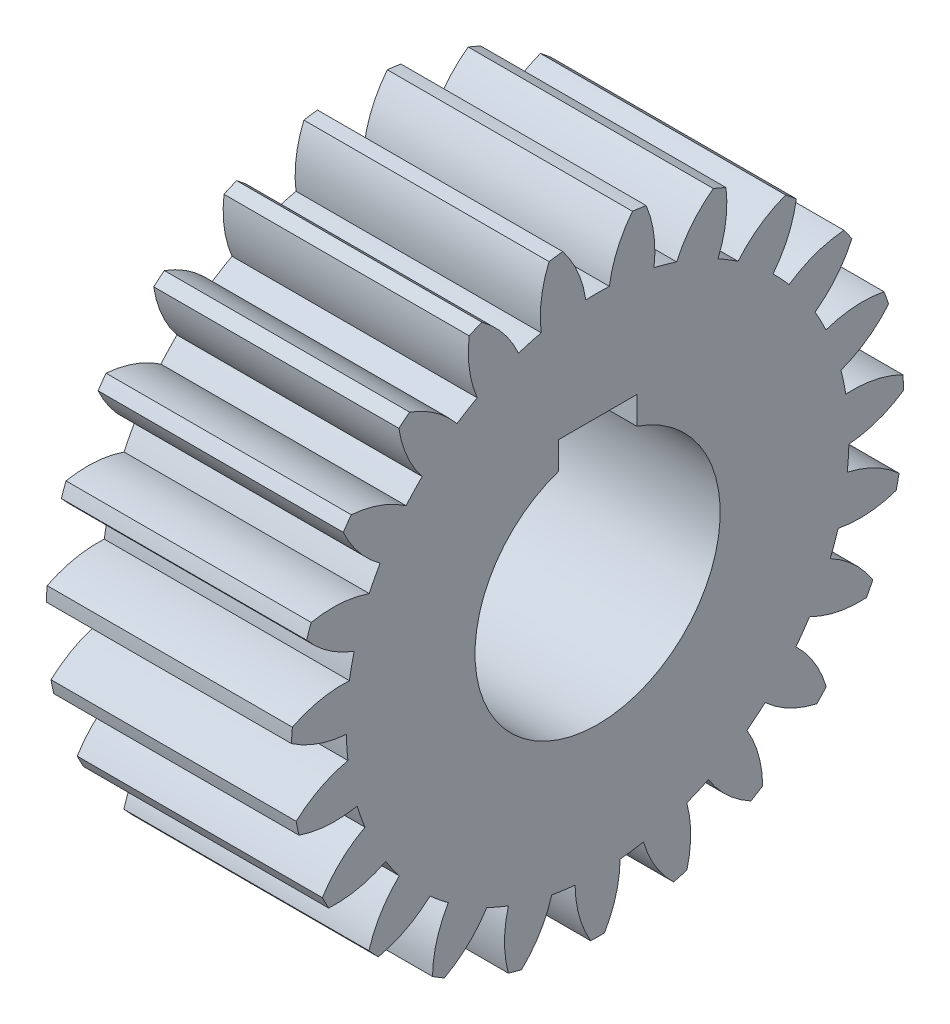
from build123d import *

# Parameters (mm, degrees)
BASPROSKE_W     = 50
BASPROSKE_H     = 62.5
TOOTHCUT_DEPTH  = 102.550480058
TEETHCUTS_COUNT = 23
TEETHCUTS_ANGLE = 344.347826087
BORSKE_R        = 25
BORE_DEPTH      = 50.0000508
KEYSKE_W        = 16
KEYSKE_H        = 29.3
KEYWAY_DEPTH    = 50.0000508


with BuildPart() as part:
    # BasProSke → Base-Revolve (revolve)
    with BuildSketch(Plane(origin=(0, 0, 0), x_dir=(1, 0, 0), z_dir=(0, 1, 0)), mode=Mode.PRIVATE) as base_revolve_sk:
        with Locations((25, 31.25)):
            Rectangle(BASPROSKE_W, BASPROSKE_H)
    revolve(base_revolve_sk.sketch.rotate(Axis((-10, 0, 0), (1, 0, 0)), 180), axis=Axis((-10, 0, 0), (1, 0, 0)))

    # TooCutSke → ToothCut (cut, through all)
    with BuildSketch(Plane(origin=(0, 0, 0), x_dir=(0, 0, -1), z_dir=(1, 0, 0))):
        with BuildLine():
            ThreePointArc((2.400061822, 51.192770039), (0, 51.249), (-2.400061822, 51.192770039))
            ThreePointArc((-2.400061822, 51.192770039), (-4.047924228, 56.96654952), (-7.134029469, 62.11707711))
            ThreePointArc((-7.134029469, 62.11707711), (0, 62.5254), (7.134029469, 62.11707711))
            ThreePointArc((7.134029469, 62.11707711), (4.047924228, 56.96654952), (2.400061822, 51.192770039))
        make_face()
    toothcut = extrude(amount=TOOTHCUT_DEPTH, mode=Mode.SUBTRACT)

    # TeethCuts: ToothCut ×23 about axis
    teethcuts_axis = Axis((-10, 0, 0), (1, 0, 0))
    for i in range(1, TEETHCUTS_COUNT):
        add(toothcut.rotate(teethcuts_axis, i * TEETHCUTS_ANGLE / (TEETHCUTS_COUNT - 1)), mode=Mode.SUBTRACT)

    # BorSke → Bore (cut, symmetric)
    with BuildSketch(Plane(origin=(0, 0, 0), x_dir=(0, 0, -1), z_dir=(1, 0, 0))):
        with Locations(Location((0, 0, 0), (0, 0, 180))):
            Circle(BORSKE_R)
    extrude(amount=BORE_DEPTH, both=True, mode=Mode.SUBTRACT)

    # KeySke → Keyway (cut, symmetric)
    with BuildSketch(Plane(origin=(0, 0, 0), x_dir=(0, 0, -1), z_dir=(1, 0, 0))):
        with Locations((0, 14.65)):
            Rectangle(KEYSKE_W, KEYSKE_H)
    extrude(amount=KEYWAY_DEPTH, both=True, mode=Mode.SUBTRACT)


solid = part.part
